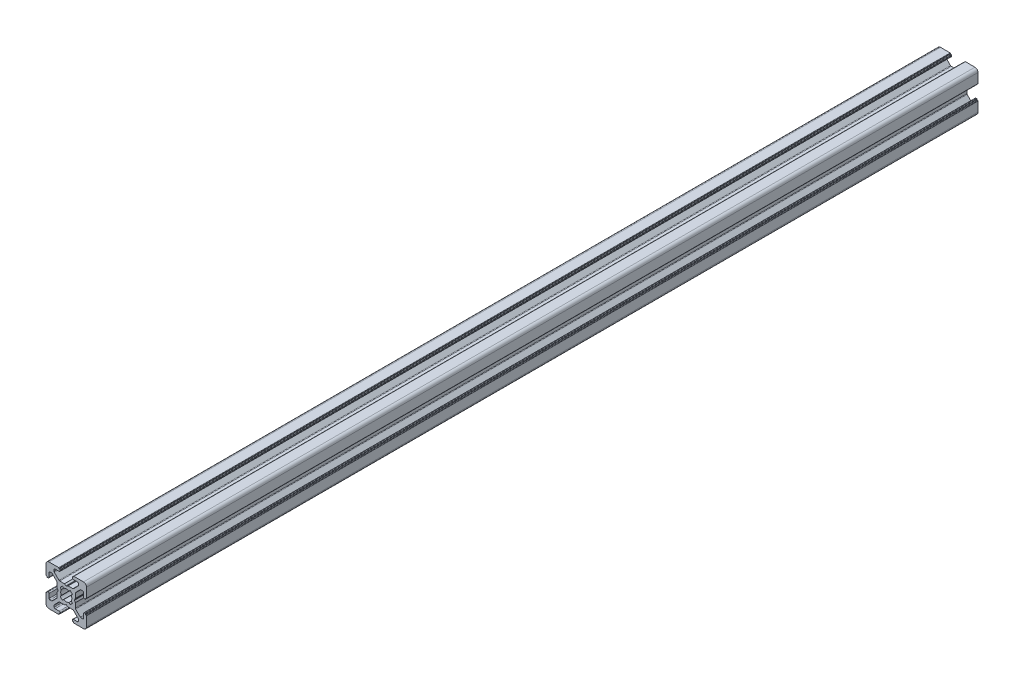
from build123d import *

# Parameters (mm, degrees)
Y_KSEKLIK_EKSTR_ZYON1_DEPTH = 220


with BuildPart() as part:
    # Çizim1 → Yükseklik-Ekstrüzyon1 (new, symmetric)
    with BuildSketch(Plane.XY):
        with BuildLine():
            Line((-3.750000227, 10), (-8.5, 10))
            ThreePointArc((-8.5, 10), (-9.560660172, 9.560660172), (-10, 8.5))
            Line((-10, 8.5), (-10, 3.749999605))
            ThreePointArc((-10, 3.749999605), (-9.941421356, 3.608578248), (-9.8, 3.549999605))
            Line((-9.8, 3.549999605), (-9.699999732, 3.549999605))
            ThreePointArc((-9.699999732, 3.549999605), (-9.558578376, 3.491420961), (-9.499999732, 3.349999605))
            Line((-9.499999732, 3.349999605), (-9.499999732, 3.2))
            ThreePointArc((-9.499999732, 3.2), (-9.441421088, 3.058578644), (-9.299999732, 3))
            Line((-9.299999732, 3), (-8.999999732, 3))
            ThreePointArc((-8.999999732, 3), (-8.646446341, 3.146446609), (-8.499999732, 3.5))
            Line((-8.499999732, 3.5), (-8.499999732, 5.499999605))
            ThreePointArc((-8.499999732, 5.499999605), (-8.353553123, 5.853552995), (-7.999999732, 5.999999605))
            Line((-7.999999732, 5.999999605), (-7.267766685, 5.999999605))
            ThreePointArc((-7.267766685, 5.999999605), (-7.076424969, 5.961939371), (-6.914213294, 5.853552995))
            Line((-6.914213294, 5.853552995), (-4.646446398, 3.585786099))
            ThreePointArc((-4.646446398, 3.585786099), (-4.538060023, 3.423574425), (-4.499999789, 3.232232709))
            Line((-4.499999789, 3.232232709), (-4.499999789, 0.953589302))
            ThreePointArc((-4.499999789, 0.953589302), (-4.493184953, 0.90182549), (-4.473204867, 0.853589298))
            Line((-4.473204867, 0.853589298), (-4.038119841, 0.099999969))
            ThreePointArc((-4.038119841, 0.099999969), (-4.011324929, 0), (-4.038119841, -0.099999969))
            Line((-4.038119841, -0.099999969), (-4.473204867, -0.853589297))
            ThreePointArc((-4.473204867, -0.853589297), (-4.493184953, -0.90182549), (-4.499999789, -0.953589302))
            Line((-4.499999789, -0.953589302), (-4.499999789, -3.232232708))
            ThreePointArc((-4.499999789, -3.232232708), (-4.538060023, -3.423574425), (-4.646446398, -3.585786099))
            Line((-4.646446398, -3.585786099), (-6.914213294, -5.853552995))
            ThreePointArc((-6.914213294, -5.853552995), (-7.076424969, -5.961939371), (-7.267766685, -5.999999605))
            Line((-7.267766685, -5.999999605), (-7.999999732, -5.999999605))
            ThreePointArc((-7.999999732, -5.999999605), (-8.353553123, -5.853552995), (-8.499999732, -5.499999605))
            Line((-8.499999732, -5.499999605), (-8.499999732, -3.5))
            ThreePointArc((-8.499999732, -3.5), (-8.646446341, -3.146446609), (-8.999999732, -3))
            Line((-8.999999732, -3), (-9.299999732, -3))
            ThreePointArc((-9.299999732, -3), (-9.441421088, -3.058578644), (-9.499999732, -3.2))
            Line((-9.499999732, -3.2), (-9.499999732, -3.349999605))
            ThreePointArc((-9.499999732, -3.349999605), (-9.558578376, -3.491420961), (-9.699999732, -3.549999605))
            Line((-9.699999732, -3.549999605), (-9.8, -3.549999605))
            ThreePointArc((-9.8, -3.549999605), (-9.941421356, -3.608578248), (-10, -3.749999605))
            Line((-10, -3.749999605), (-10, -8.5))
            ThreePointArc((-10, -8.5), (-9.560660172, -9.560660172), (-8.5, -10))
            Line((-8.5, -10), (-3.750000227, -10))
            ThreePointArc((-3.750000227, -10), (-3.608578871, -9.941421356), (-3.550000227, -9.8))
            Line((-3.550000227, -9.8), (-3.550000227, -9.7))
            ThreePointArc((-3.550000227, -9.7), (-3.491421584, -9.558578644), (-3.350000227, -9.5))
            Line((-3.350000227, -9.5), (-3.2, -9.5))
            ThreePointArc((-3.2, -9.5), (-3.058578644, -9.441421356), (-3, -9.3))
            Line((-3, -9.3), (-3, -8.999999673))
            ThreePointArc((-3, -8.999999673), (-3.146446609, -8.646446283), (-3.5, -8.499999673))
            Line((-3.5, -8.499999673), (-5.500000686, -8.499999673))
            ThreePointArc((-5.500000686, -8.499999673), (-5.853554077, -8.353553064), (-6.000000686, -7.999999673))
            Line((-6.000000686, -7.999999673), (-6.000000686, -7.267766626))
            ThreePointArc((-6.000000686, -7.267766626), (-5.961940448, -7.076424899), (-5.853554059, -6.914213219))
            Line((-5.853554059, -6.914213219), (-3.585787212, -4.646446592))
            ThreePointArc((-3.585787212, -4.646446592), (-3.423575544, -4.538060229), (-3.232233839, -4.5))
            Line((-3.232233839, -4.5), (-0.953590312, -4.5))
            ThreePointArc((-0.953590312, -4.5), (-0.901826505, -4.493185166), (-0.853590316, -4.473205083))
            Line((-0.853590316, -4.473205083), (-0.100000045, -4.038119562))
            ThreePointArc((-0.100000045, -4.038119562), (0, -4.011324632), (0.100000045, -4.038119562))
            Line((0.100000045, -4.038119562), (0.853590316, -4.473205083))
            ThreePointArc((0.853590316, -4.473205083), (0.901826505, -4.493185166), (0.953590312, -4.5))
            Line((0.953590312, -4.5), (3.232233839, -4.5))
            ThreePointArc((3.232233839, -4.5), (3.423575544, -4.538060229), (3.585787212, -4.646446592))
            Line((3.585787212, -4.646446592), (5.853554059, -6.914213218))
            ThreePointArc((5.853554059, -6.914213218), (5.961940448, -7.076424899), (6.000000686, -7.267766626))
            Line((6.000000686, -7.267766626), (6.000000686, -7.999999673))
            ThreePointArc((6.000000686, -7.999999673), (5.853554077, -8.353553064), (5.500000686, -8.499999673))
            Line((5.500000686, -8.499999673), (3.5, -8.499999673))
            ThreePointArc((3.5, -8.499999673), (3.146446609, -8.646446283), (3, -8.999999673))
            Line((3, -8.999999673), (3, -9.3))
            ThreePointArc((3, -9.3), (3.058578644, -9.441421356), (3.2, -9.5))
            Line((3.2, -9.5), (3.350000228, -9.5))
            ThreePointArc((3.350000228, -9.5), (3.491421584, -9.558578644), (3.550000228, -9.7))
            Line((3.550000228, -9.7), (3.550000228, -9.8))
            ThreePointArc((3.550000228, -9.8), (3.608578871, -9.941421356), (3.750000228, -10))
            Line((3.750000228, -10), (8.5, -10))
            ThreePointArc((8.5, -10), (9.560660172, -9.560660172), (10, -8.5))
            Line((10, -8.5), (10, -3.749999605))
            ThreePointArc((10, -3.749999605), (9.941421356, -3.608578248), (9.8, -3.549999605))
            Line((9.8, -3.549999605), (9.699999732, -3.549999605))
            ThreePointArc((9.699999732, -3.549999605), (9.558578376, -3.491420961), (9.499999732, -3.349999605))
            Line((9.499999732, -3.349999605), (9.499999732, -3.2))
            ThreePointArc((9.499999732, -3.2), (9.441421088, -3.058578644), (9.299999732, -3))
            Line((9.299999732, -3), (8.999999732, -3))
            ThreePointArc((8.999999732, -3), (8.646446341, -3.146446609), (8.499999732, -3.5))
            Line((8.499999732, -3.5), (8.499999732, -5.499999605))
            ThreePointArc((8.499999732, -5.499999605), (8.353553123, -5.853552995), (7.999999732, -5.999999605))
            Line((7.999999732, -5.999999605), (7.267766685, -5.999999605))
            ThreePointArc((7.267766685, -5.999999605), (7.076424969, -5.961939371), (6.914213294, -5.853552995))
            Line((6.914213294, -5.853552995), (4.646446398, -3.585786099))
            ThreePointArc((4.646446398, -3.585786099), (4.538060023, -3.423574425), (4.499999789, -3.232232708))
            Line((4.499999789, -3.232232708), (4.499999789, -0.953589302))
            ThreePointArc((4.499999789, -0.953589302), (4.493184953, -0.90182549), (4.473204867, -0.853589297))
            Line((4.473204867, -0.853589297), (4.038119841, -0.099999969))
            ThreePointArc((4.038119841, -0.099999969), (4.011324929, 0), (4.038119841, 0.099999969))
            Line((4.038119841, 0.099999969), (4.473204867, 0.853589298))
            ThreePointArc((4.473204867, 0.853589298), (4.493184953, 0.90182549), (4.499999789, 0.953589302))
            Line((4.499999789, 0.953589302), (4.499999789, 3.232232709))
            ThreePointArc((4.499999789, 3.232232709), (4.538060023, 3.423574425), (4.646446398, 3.585786099))
            Line((4.646446398, 3.585786099), (6.914213294, 5.853552995))
            ThreePointArc((6.914213294, 5.853552995), (7.076424969, 5.961939371), (7.267766685, 5.999999605))
            Line((7.267766685, 5.999999605), (7.999999732, 5.999999605))
            ThreePointArc((7.999999732, 5.999999605), (8.353553123, 5.853552995), (8.499999732, 5.499999605))
            Line((8.499999732, 5.499999605), (8.499999732, 3.5))
            ThreePointArc((8.499999732, 3.5), (8.646446341, 3.146446609), (8.999999732, 3))
            Line((8.999999732, 3), (9.299999732, 3))
            ThreePointArc((9.299999732, 3), (9.441421088, 3.058578644), (9.499999732, 3.2))
            Line((9.499999732, 3.2), (9.499999732, 3.349999605))
            ThreePointArc((9.499999732, 3.349999605), (9.558578376, 3.491420961), (9.699999732, 3.549999605))
            Line((9.699999732, 3.549999605), (9.8, 3.549999605))
            ThreePointArc((9.8, 3.549999605), (9.941421356, 3.608578248), (10, 3.749999605))
            Line((10, 3.749999605), (10, 8.5))
            ThreePointArc((10, 8.5), (9.560660172, 9.560660172), (8.5, 10))
            Line((8.5, 10), (3.750000228, 10))
            ThreePointArc((3.750000228, 10), (3.608578871, 9.941421356), (3.550000228, 9.8))
            Line((3.550000228, 9.8), (3.550000228, 9.7))
            ThreePointArc((3.550000228, 9.7), (3.491421584, 9.558578644), (3.350000228, 9.5))
            Line((3.350000228, 9.5), (3.2, 9.5))
            ThreePointArc((3.2, 9.5), (3.058578644, 9.441421356), (3, 9.3))
            Line((3, 9.3), (3, 8.999999673))
            ThreePointArc((3, 8.999999673), (3.146446609, 8.646446283), (3.5, 8.499999673))
            Line((3.5, 8.499999673), (5.500000686, 8.499999673))
            ThreePointArc((5.500000686, 8.499999673), (5.853554077, 8.353553064), (6.000000686, 7.999999673))
            Line((6.000000686, 7.999999673), (6.000000686, 7.267766626))
            ThreePointArc((6.000000686, 7.267766626), (5.961940448, 7.076424899), (5.853554059, 6.914213219))
            Line((5.853554059, 6.914213219), (3.585787212, 4.646446592))
            ThreePointArc((3.585787212, 4.646446592), (3.423575544, 4.538060229), (3.232233839, 4.5))
            Line((3.232233839, 4.5), (0.953590312, 4.5))
            ThreePointArc((0.953590312, 4.5), (0.901826505, 4.493185166), (0.853590316, 4.473205083))
            Line((0.853590316, 4.473205083), (0.100000045, 4.038119562))
            ThreePointArc((0.100000045, 4.038119562), (0, 4.011324632), (-0.100000045, 4.038119562))
            Line((-0.100000045, 4.038119562), (-0.853590316, 4.473205083))
            ThreePointArc((-0.853590316, 4.473205083), (-0.901826505, 4.493185166), (-0.953590312, 4.5))
            Line((-0.953590312, 4.5), (-3.232233839, 4.5))
            ThreePointArc((-3.232233839, 4.5), (-3.423575544, 4.538060229), (-3.585787212, 4.646446592))
            Line((-3.585787212, 4.646446592), (-5.853554059, 6.914213219))
            ThreePointArc((-5.853554059, 6.914213219), (-5.961940448, 7.076424899), (-6.000000686, 7.267766626))
            Line((-6.000000686, 7.267766626), (-6.000000686, 7.999999673))
            ThreePointArc((-6.000000686, 7.999999673), (-5.853554077, 8.353553064), (-5.500000686, 8.499999673))
            Line((-5.500000686, 8.499999673), (-3.5, 8.499999673))
            ThreePointArc((-3.5, 8.499999673), (-3.146446609, 8.646446283), (-3, 8.999999673))
            Line((-3, 8.999999673), (-3, 9.3))
            ThreePointArc((-3, 9.3), (-3.058578644, 9.441421356), (-3.2, 9.5))
            Line((-3.2, 9.5), (-3.350000227, 9.5))
            ThreePointArc((-3.350000227, 9.5), (-3.491421584, 9.558578644), (-3.550000227, 9.7))
            Line((-3.550000227, 9.7), (-3.550000227, 9.8))
            ThreePointArc((-3.550000227, 9.8), (-3.608578871, 9.941421356), (-3.750000227, 10))
        make_face()
        with BuildLine():
            Line((-2.992174953, 1.909930962), (-2.445295424, 1.258185317))
            ThreePointArc((-2.445295424, 1.258185317), (-2.75, 0), (-2.445295424, -1.258185317))
            Line((-2.445295424, -1.258185317), (-2.992174953, -1.909930962))
            ThreePointArc((-2.992174953, -1.909930962), (-2.511737261, -2.508410485), (-1.913895019, -2.989640962))
            Line((-1.913895019, -2.989640962), (-1.258185436, -2.445295362))
            ThreePointArc((-1.258185436, -2.445295362), (0, -2.75), (1.258185436, -2.445295362))
            Line((1.258185436, -2.445295362), (1.91389502, -2.989640962))
            ThreePointArc((1.91389502, -2.989640962), (2.511737261, -2.508410485), (2.992174953, -1.909930962))
            Line((2.992174953, -1.909930962), (2.445295424, -1.258185317))
            ThreePointArc((2.445295424, -1.258185317), (2.75, 0), (2.445295424, 1.258185317))
            Line((2.445295424, 1.258185317), (2.992174953, 1.909930962))
            ThreePointArc((2.992174953, 1.909930962), (2.511737261, 2.508410485), (1.91389502, 2.989640962))
            Line((1.91389502, 2.989640962), (1.258185436, 2.445295362))
            ThreePointArc((1.258185436, 2.445295362), (0, 2.75), (-1.258185436, 2.445295362))
            Line((-1.258185436, 2.445295362), (-1.913895019, 2.989640962))
            ThreePointArc((-1.913895019, 2.989640962), (-2.511737261, 2.508410485), (-2.992174953, 1.909930962))
        make_face(mode=Mode.SUBTRACT)
    extrude(amount=Y_KSEKLIK_EKSTR_ZYON1_DEPTH, both=True)


solid = part.part
